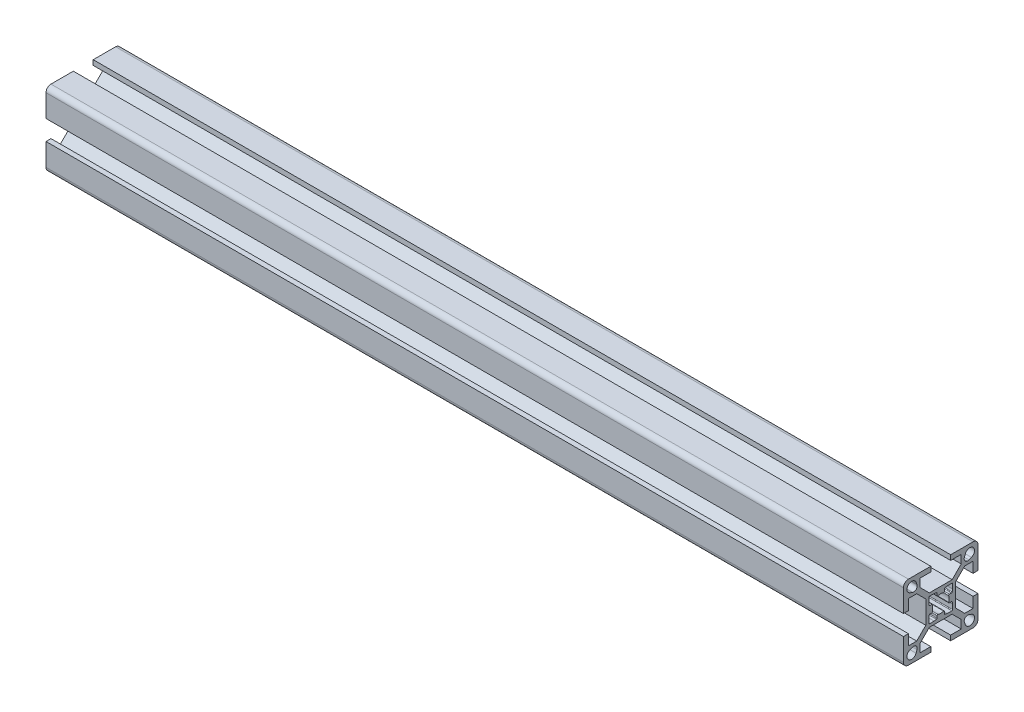
from build123d import *

# Parameters (mm, degrees)
BOSS_EXTRUDE1_DEPTH = 345


with BuildPart() as part:
    # Sketch1 → Boss-Extrude1 (new body)
    with BuildSketch(Plane(origin=(0, 0, 0), x_dir=(0, 0, -1), z_dir=(1, 0, 0))):
        with BuildLine():
            Line((-15, 13), (-15, 4))
            Line((-15, 4), (-13, 4))
            Line((-13, 4), (-13, 8.25))
            Line((-13, 8.25), (-9.664213562, 8.25))
            Line((-9.664213562, 8.25), (-6, 4.585786438))
            Line((-6, 4.585786438), (-6, -4.585786438))
            Line((-6, -4.585786438), (-9.664213562, -8.25))
            Line((-9.664213562, -8.25), (-13, -8.25))
            Line((-13, -8.25), (-13, -4))
            Line((-13, -4), (-15, -4))
            Line((-15, -4), (-15, -13))
            ThreePointArc((-15, -13), (-14.414213562, -14.414213562), (-13, -15))
            Line((-13, -15), (-4, -15))
            Line((-4, -15), (-4, -13))
            Line((-4, -13), (-8.25, -13))
            Line((-8.25, -13), (-8.25, -9.664213562))
            Line((-8.25, -9.664213562), (-4.585786438, -6))
            Line((-4.585786438, -6), (4.585786438, -6))
            Line((4.585786438, -6), (8.25, -9.664213562))
            Line((8.25, -9.664213562), (8.25, -13))
            Line((8.25, -13), (4, -13))
            Line((4, -13), (4, -15))
            Line((4, -15), (13, -15))
            ThreePointArc((13, -15), (14.414213562, -14.414213562), (15, -13))
            Line((15, -13), (15, -4))
            Line((15, -4), (13, -4))
            Line((13, -4), (13, -8.25))
            Line((13, -8.25), (9.664213562, -8.25))
            Line((9.664213562, -8.25), (6, -4.585786438))
            Line((6, -4.585786438), (6, 4.585786438))
            Line((6, 4.585786438), (9.664213562, 8.25))
            Line((9.664213562, 8.25), (13, 8.25))
            Line((13, 8.25), (13, 4))
            Line((13, 4), (15, 4))
            Line((15, 4), (15, 13))
            ThreePointArc((15, 13), (14.414213562, 14.414213562), (13, 15))
            Line((13, 15), (4, 15))
            Line((4, 15), (4, 13))
            Line((4, 13), (8.25, 13))
            Line((8.25, 13), (8.25, 9.664213562))
            Line((8.25, 9.664213562), (4.585786438, 6))
            Line((4.585786438, 6), (-4.585786438, 6))
            Line((-4.585786438, 6), (-8.25, 9.664213562))
            Line((-8.25, 9.664213562), (-8.25, 13))
            Line((-8.25, 13), (-4, 13))
            Line((-4, 13), (-4, 15))
            Line((-4, 15), (-13, 15))
            ThreePointArc((-13, 15), (-14.414213562, 14.414213562), (-15, 13))
        make_face()
        with BuildLine():
            Line((-9.539070071, 11.338915743), (-9.918883282, 12.361530981))
            ThreePointArc((-9.918883282, 12.361530981), (-13.043502884, 13.043502884), (-12.361530981, 9.918883282))
            Line((-12.361530981, 9.918883282), (-11.338915743, 9.539070071))
            ThreePointArc((-11.338915743, 9.539070071), (-9.861522369, 9.861522369), (-9.539070071, 11.338915743))
        make_face(mode=Mode.SUBTRACT)
        with BuildLine():
            Line((9.918883282, 12.361530981), (9.539070071, 11.338915743))
            ThreePointArc((9.539070071, 11.338915743), (9.861522369, 9.861522369), (11.338915743, 9.539070071))
            Line((11.338915743, 9.539070071), (12.361530981, 9.918883282))
            ThreePointArc((12.361530981, 9.918883282), (13.043502884, 13.043502884), (9.918883282, 12.361530981))
        make_face(mode=Mode.SUBTRACT)
        with BuildLine():
            Line((12.361530981, -9.918883282), (11.338915743, -9.539070071))
            ThreePointArc((11.338915743, -9.539070071), (9.861522369, -9.861522369), (9.539070071, -11.338915743))
            Line((9.539070071, -11.338915743), (9.918883282, -12.361530981))
            ThreePointArc((9.918883282, -12.361530981), (13.043502884, -13.043502884), (12.361530981, -9.918883282))
        make_face(mode=Mode.SUBTRACT)
        with BuildLine():
            Line((-11.338915743, -9.539070071), (-12.361530981, -9.918883282))
            ThreePointArc((-12.361530981, -9.918883282), (-13.043502884, -13.043502884), (-9.918883282, -12.361530981))
            Line((-9.918883282, -12.361530981), (-9.539070071, -11.338915743))
            ThreePointArc((-9.539070071, -11.338915743), (-9.861522369, -9.861522369), (-11.338915743, -9.539070071))
        make_face(mode=Mode.SUBTRACT)
        with BuildLine():
            Line((-4.8, -2.644433572), (-4.8, -4.5))
            ThreePointArc((-4.8, -4.5), (-4.712132034, -4.712132034), (-4.5, -4.8))
            Line((-4.5, -4.8), (-2.644433572, -4.8))
            ThreePointArc((-2.644433572, -4.8), (-2.615679847, -4.79861886), (-2.587190874, -4.794488155))
            Line((-2.587190874, -4.794488155), (-1.742757301, -4.630346896))
            ThreePointArc((-1.742757301, -4.630346896), (-1.568512625, -4.526682207), (-1.5, -4.335858741))
            Line((-1.5, -4.335858741), (-1.5, -3.5))
            ThreePointArc((-1.5, -3.5), (-1.374371458, -3.255879959), (-1.102702703, -3.216216216))
            ThreePointArc((-1.102702703, -3.216216216), (0, -3.4), (1.102702703, -3.216216216))
            ThreePointArc((1.102702703, -3.216216216), (1.374371458, -3.255879959), (1.5, -3.5))
            Line((1.5, -3.5), (1.5, -4.335858741))
            ThreePointArc((1.5, -4.335858741), (1.568512625, -4.526682207), (1.742757301, -4.630346896))
            Line((1.742757301, -4.630346896), (2.587190874, -4.794488155))
            ThreePointArc((2.587190874, -4.794488155), (2.615679847, -4.79861886), (2.644433572, -4.8))
            Line((2.644433572, -4.8), (4.5, -4.8))
            ThreePointArc((4.5, -4.8), (4.712132034, -4.712132034), (4.8, -4.5))
            Line((4.8, -4.5), (4.8, -2.644433572))
            ThreePointArc((4.8, -2.644433572), (4.79861886, -2.615679847), (4.794488155, -2.587190874))
            Line((4.794488155, -2.587190874), (4.630346896, -1.742757301))
            ThreePointArc((4.630346896, -1.742757301), (4.526682207, -1.568512625), (4.335858741, -1.5))
            Line((4.335858741, -1.5), (3.5, -1.5))
            ThreePointArc((3.5, -1.5), (3.255879959, -1.374371458), (3.216216216, -1.102702703))
            ThreePointArc((3.216216216, -1.102702703), (3.4, 0), (3.216216216, 1.102702703))
            ThreePointArc((3.216216216, 1.102702703), (3.255879959, 1.374371458), (3.5, 1.5))
            Line((3.5, 1.5), (4.335858741, 1.5))
            ThreePointArc((4.335858741, 1.5), (4.526682207, 1.568512625), (4.630346896, 1.742757301))
            Line((4.630346896, 1.742757301), (4.794488155, 2.587190874))
            ThreePointArc((4.794488155, 2.587190874), (4.79861886, 2.615679847), (4.8, 2.644433572))
            Line((4.8, 2.644433572), (4.8, 4.5))
            ThreePointArc((4.8, 4.5), (4.712132034, 4.712132034), (4.5, 4.8))
            Line((4.5, 4.8), (2.644433572, 4.8))
            ThreePointArc((2.644433572, 4.8), (2.615679847, 4.79861886), (2.587190874, 4.794488155))
            Line((2.587190874, 4.794488155), (1.742757301, 4.630346896))
            ThreePointArc((1.742757301, 4.630346896), (1.568512625, 4.526682207), (1.5, 4.335858741))
            Line((1.5, 4.335858741), (1.5, 3.5))
            ThreePointArc((1.5, 3.5), (1.374371458, 3.255879959), (1.102702703, 3.216216216))
            ThreePointArc((1.102702703, 3.216216216), (0, 3.4), (-1.102702703, 3.216216216))
            ThreePointArc((-1.102702703, 3.216216216), (-1.374371458, 3.255879959), (-1.5, 3.5))
            Line((-1.5, 3.5), (-1.5, 4.335858741))
            ThreePointArc((-1.5, 4.335858741), (-1.568512625, 4.526682207), (-1.742757301, 4.630346896))
            Line((-1.742757301, 4.630346896), (-2.587190874, 4.794488155))
            ThreePointArc((-2.587190874, 4.794488155), (-2.615679847, 4.79861886), (-2.644433572, 4.8))
            Line((-2.644433572, 4.8), (-4.5, 4.8))
            ThreePointArc((-4.5, 4.8), (-4.712132034, 4.712132034), (-4.8, 4.5))
            Line((-4.8, 4.5), (-4.8, 2.644433572))
            ThreePointArc((-4.8, 2.644433572), (-4.79861886, 2.615679847), (-4.794488155, 2.587190874))
            Line((-4.794488155, 2.587190874), (-4.630346896, 1.742757301))
            ThreePointArc((-4.630346896, 1.742757301), (-4.526682207, 1.568512625), (-4.335858741, 1.5))
            Line((-4.335858741, 1.5), (-3.5, 1.5))
            ThreePointArc((-3.5, 1.5), (-3.255879959, 1.374371458), (-3.216216216, 1.102702703))
            ThreePointArc((-3.216216216, 1.102702703), (-3.4, 0), (-3.216216216, -1.102702703))
            ThreePointArc((-3.216216216, -1.102702703), (-3.255879959, -1.374371458), (-3.5, -1.5))
            Line((-3.5, -1.5), (-4.335858741, -1.5))
            ThreePointArc((-4.335858741, -1.5), (-4.526682207, -1.568512625), (-4.630346896, -1.742757301))
            Line((-4.630346896, -1.742757301), (-4.794488155, -2.587190874))
            ThreePointArc((-4.794488155, -2.587190874), (-4.79861886, -2.615679847), (-4.8, -2.644433572))
        make_face(mode=Mode.SUBTRACT)
    extrude(amount=BOSS_EXTRUDE1_DEPTH)


solid = part.part
